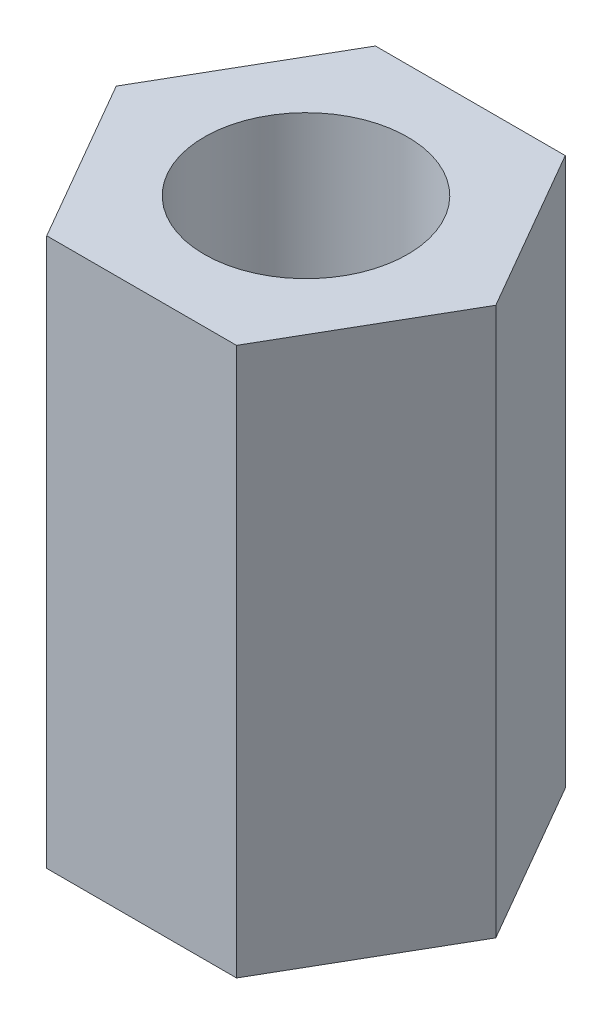
from build123d import *

# Parameters (mm, degrees)
BOSS_EXTRUDE1_DEPTH              = 7.9375
F_97_0_0059_DIAMETER_HOLE1_D     = 2.9464
F_97_0_0059_DIAMETER_HOLE1_DEPTH = 25.4
F_97_0_0059_DIAMETER_HOLE1_TIP   = 0.885187864


with BuildPart() as part:
    # Sketch1 → Boss-Extrude1 (new body)
    with BuildSketch(Plane(origin=(0, 0, 0), x_dir=(1, 0, 0), z_dir=(0, 1, 0))):
        Polygon((2.749630657, 0), (1.374815329, 2.38125), (-1.374815329, 2.38125), (-2.749630657, 0), (-1.374815329, -2.38125), (1.374815329, -2.38125), align=None)
    extrude(amount=BOSS_EXTRUDE1_DEPTH)

    # #97 (0.0059) Diameter Hole1
    with Locations(Plane(origin=(0, 7.9375, 0), x_dir=(1, 0, 0), z_dir=(0, 1, 0))):
        with Locations((0, 0)):
            Hole(F_97_0_0059_DIAMETER_HOLE1_D / 2, depth=F_97_0_0059_DIAMETER_HOLE1_DEPTH)
            with Locations((0, 0, -(F_97_0_0059_DIAMETER_HOLE1_DEPTH + F_97_0_0059_DIAMETER_HOLE1_TIP / 2))):  # 118° drill point
                Cone(0, F_97_0_0059_DIAMETER_HOLE1_D / 2, F_97_0_0059_DIAMETER_HOLE1_TIP, mode=Mode.SUBTRACT)


solid = part.part
